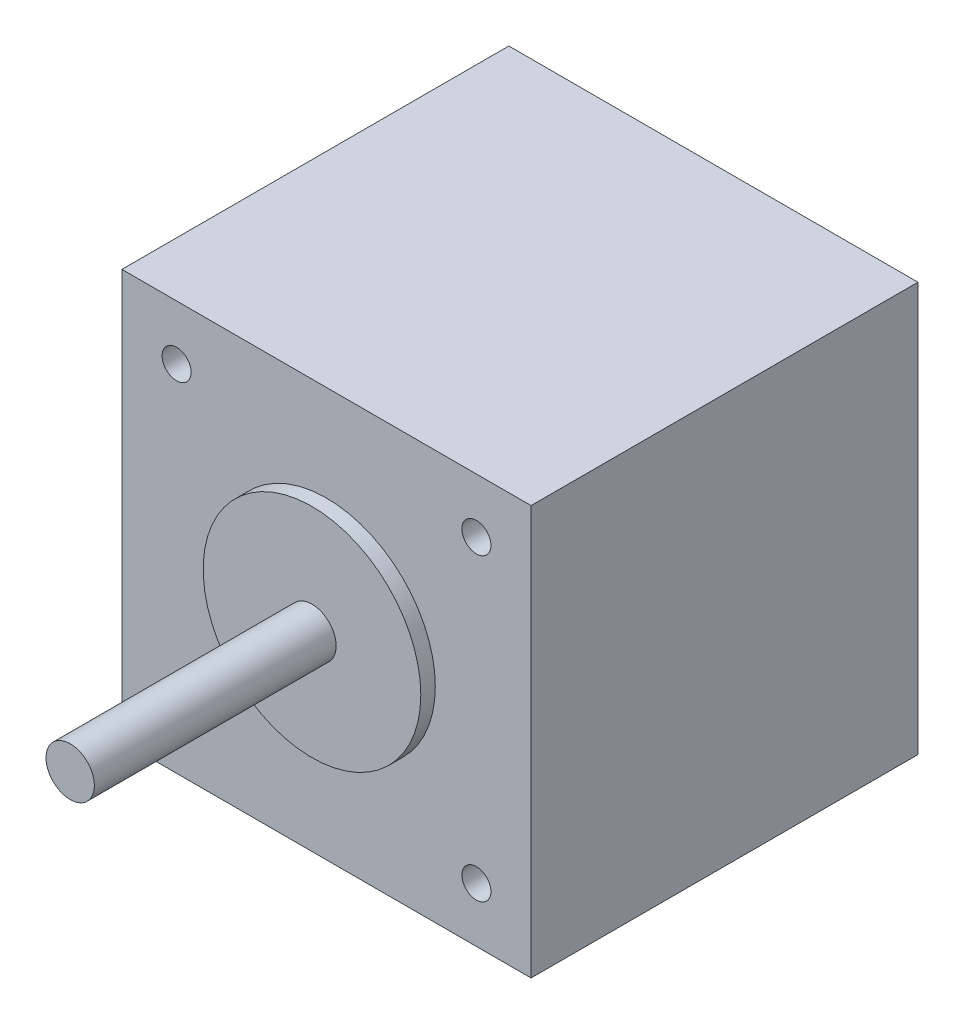
from build123d import *

# Parameters (mm, degrees)
SKETCH1_W                = 42.3
SKETCH1_H                = 42.3
BOSS_EXTRUDE1_DEPTH      = 40
SKETCH1_3_R              = 1.5
CUT_EXTRUDE1_DEPTH       = 5
SKETCH1_4_R              = 11.25
SKETCH1_4_R_2            = 2.5
BOSS_EXTRUDE2_DEPTH      = 1.5
BOSS_EXTRUDE3_DEPTH      = 25
BOSS_EXTRUDE3_DEPTH_BACK = 40
BOSS_EXTRUDE3_START      = 1.5
SKETCH1_5_R              = 2.5
SKETCH3_W                = 17
SKETCH3_H                = 9
BOSS_EXTRUDE4_DEPTH      = 5


with BuildPart() as part:
    # Sketch1 → Boss-Extrude1 (new body)
    with BuildSketch(Plane.XY):
        Rectangle(SKETCH1_W, SKETCH1_H)
    extrude(amount=-BOSS_EXTRUDE1_DEPTH)

    # Sketch1<3> → Cut-Extrude1 (cut)
    with BuildSketch(Plane.XY):
        with Locations((-15.5, -15.5)):
            Circle(SKETCH1_3_R)
        with Locations((15.5, 15.5)):
            Circle(SKETCH1_3_R)
        with Locations((15.5, -15.5)):
            Circle(SKETCH1_3_R)
        with Locations((-15.5, 15.5)):
            Circle(SKETCH1_3_R)
    extrude(amount=-CUT_EXTRUDE1_DEPTH, mode=Mode.SUBTRACT)

    # Sketch1<4> → Boss-Extrude2 (add)
    with BuildSketch(Plane.XY):
        Circle(SKETCH1_4_R)
        Circle(SKETCH1_4_R_2, mode=Mode.SUBTRACT)
    extrude(amount=BOSS_EXTRUDE2_DEPTH)

    # Sketch1<5> → Boss-Extrude3 (add, two sides: drawn at the far end of the back side and taken through both)
    with BuildSketch(Plane.XY.offset(BOSS_EXTRUDE3_START - BOSS_EXTRUDE3_DEPTH_BACK)):
        Circle(SKETCH1_5_R)
    extrude(amount=BOSS_EXTRUDE3_DEPTH + BOSS_EXTRUDE3_DEPTH_BACK)

    # Sketch3 → Boss-Extrude4 (add)
    with BuildSketch(Plane.XZ.offset(21.15)):
        with Locations((0, -35.5)):
            Rectangle(SKETCH3_W, SKETCH3_H)
    extrude(amount=BOSS_EXTRUDE4_DEPTH)


solid = part.part
